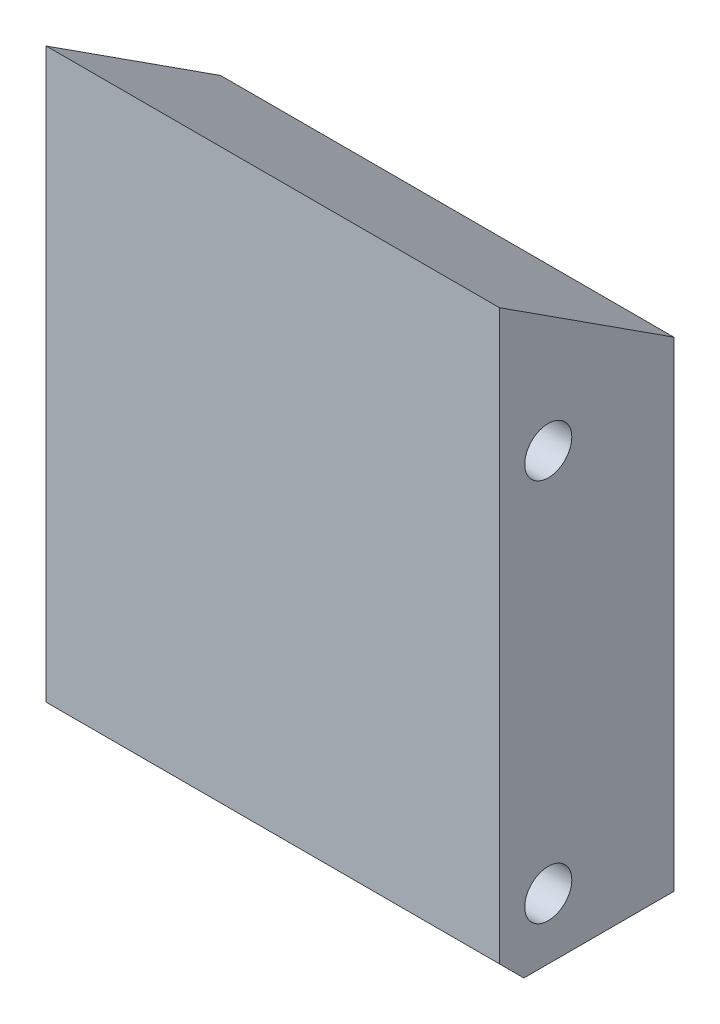
from build123d import *

# Parameters (mm, degrees)
ESBO_O1_W                  = 26
ESBO_O1_H                  = 34
RESSALTO_EXTRUS_O1_DEPTH   = 10
CHANFRO1_SIZE              = 1.4
CORTE_EXTRUS_O1_DEPTH      = 24.622023622
CORTE_EXTRUS_O1_DEPTH_BACK = 24.622023622
ESBO_O3_R                  = 1.025
CORTE_EXTRUS_O2_DEPTH      = 10
ESBO_O4_R                  = 1.35
CORTE_EXTRUS_O3_DEPTH      = 10
ESBO_O5_R                  = 1.35
CORTE_EXTRUS_O4_DEPTH      = 4


with BuildPart() as part:
    # Esboço1 → Ressalto-extrusão1 (new body)
    with BuildSketch(Plane.XY):
        Rectangle(ESBO_O1_W, ESBO_O1_H)
    extrude(amount=RESSALTO_EXTRUS_O1_DEPTH)

    # Chanfro1
    chanfro1_edges = [part.edges().sort_by_distance(p)[0] for p in [
        (0, -17, 10),
    ]]
    chamfer(chanfro1_edges, length=CHANFRO1_SIZE)

    # Esboço2 → Corte-extrusão1 (cut, two sides: drawn at the far end of the back side and taken through both)
    with BuildSketch(Plane(origin=(0, 0, 0), x_dir=(0, 0, -1), z_dir=(1, 0, 0)).offset(-CORTE_EXTRUS_O1_DEPTH_BACK)):
        Polygon((-10, 17), (0, 17), (0, 10.53807019), align=None)
    extrude(amount=CORTE_EXTRUS_O1_DEPTH + CORTE_EXTRUS_O1_DEPTH_BACK, mode=Mode.SUBTRACT)

    # Esboço3 → Corte-extrusão2 (cut)
    with BuildSketch(Plane.ZY.offset(13)):
        with Locations((7.2, 8.5)):
            Circle(ESBO_O3_R)
        with Locations((7.2, -13.5)):
            Circle(ESBO_O3_R)
    extrude(amount=-CORTE_EXTRUS_O2_DEPTH, mode=Mode.SUBTRACT)

    # Esboço4 → Corte-extrusão3 (cut)
    with BuildSketch(Plane(origin=(13, 0, 0), x_dir=(0, 0, -1), z_dir=(1, 0, 0))):
        with Locations((-7.2, 8.5)):
            Circle(ESBO_O4_R)
        with Locations((-7.2, -13.5)):
            Circle(ESBO_O4_R)
    extrude(amount=-CORTE_EXTRUS_O3_DEPTH, mode=Mode.SUBTRACT)

    # Esboço5 → Corte-extrusão4 (cut)
    with BuildSketch(Plane(origin=(0, 0, 0), x_dir=(-1, 0, 0), z_dir=(0, 0, -1))):
        with Locations((7, 0)):
            Circle(ESBO_O5_R)
        with Locations((0, -7)):
            Circle(ESBO_O5_R)
        with Locations((-7, 0)):
            Circle(ESBO_O5_R)
        with Locations((0, 7)):
            Circle(ESBO_O5_R)
    extrude(amount=-CORTE_EXTRUS_O4_DEPTH, mode=Mode.SUBTRACT)


solid = part.part
